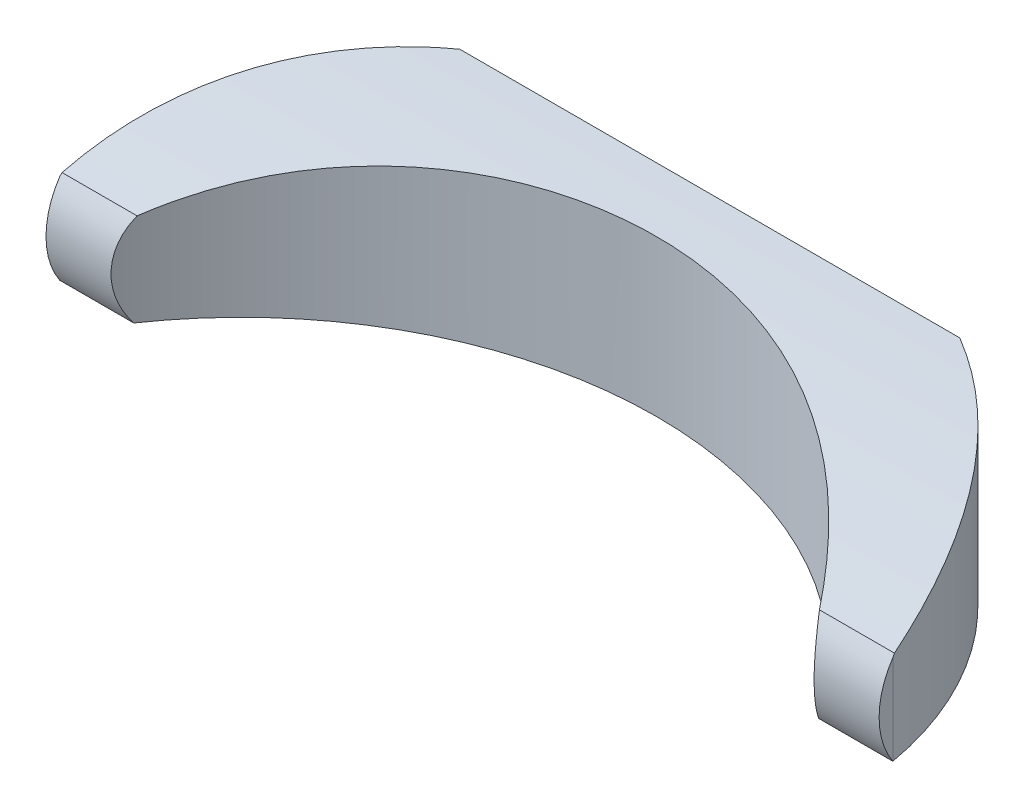
from build123d import *

# Parameters (mm, degrees)
SKETCH2_W           = 500
SKETCH2_H           = 150
BOSS_EXTRUDE1_DEPTH = 100
CUT_EXTRUDE1_DEPTH  = 540
SKETCH5_R           = 249.318658331
CUT_EXTRUDE2_DEPTH  = 560
CUT_EXTRUDE3_DEPTH  = 560


with BuildPart() as part:
    # Sketch2 → Boss-Extrude1 (new body)
    with BuildSketch(Plane(origin=(0, 0, 0), x_dir=(1, 0, 0), z_dir=(0, 1, 0))):
        with Locations((96.358792185, 13.36589698)):
            Rectangle(SKETCH2_W, SKETCH2_H)
    extrude(amount=BOSS_EXTRUDE1_DEPTH)

    # Sketch4 → Cut-Extrude1 (cut)
    with BuildSketch(Plane.ZY.offset(153.641207815)):
        with BuildLine():
            Line((-88.36589698, 100), (61.63410302, 100))
            Line((61.63410302, 100), (61.63410302, 50))
            Line((61.63410302, 50), (61.63410302, 0))
            Line((61.63410302, 0), (51.789240426, 0))
            ThreePointArc((51.789240426, 0), (60.017726044, 27.945379527), (50.617731539, 55.518778225))
            ThreePointArc((50.617731539, 55.518778225), (-17.284897104, 82.724872852), (-88.36589698, 100))
        make_face()
    extrude(amount=-CUT_EXTRUDE1_DEPTH, mode=Mode.SUBTRACT)

    # Sketch5 → Cut-Extrude2 (cut)
    with BuildSketch(Plane(origin=(0, 100, 0), x_dir=(-1, 0, 0), z_dir=(0, -1, 0))):
        with Locations((-96.358792185, -192.841012905)):
            Circle(SKETCH5_R)
    extrude(amount=CUT_EXTRUDE2_DEPTH, mode=Mode.SUBTRACT)

    # Sketch6 → Cut-Extrude3 (cut)
    with BuildSketch(Plane(origin=(0, 100, 0), x_dir=(-1, 0, 0), z_dir=(0, -1, 0))):
        with BuildLine():
            Line((-246.358792185, 88.36589698), (-346.358792185, 88.36589698))
            Line((-346.358792185, 88.36589698), (-346.358792185, -51.789240426))
            ThreePointArc((-346.358792185, -51.789240426), (-312.212496259, 29.599868023), (-246.358792185, 88.36589698))
        make_face()
        with BuildLine():
            Line((53.641207815, 88.36589698), (153.641207815, 88.36589698))
            Line((153.641207815, 88.36589698), (153.641207815, -51.789240426))
            ThreePointArc((153.641207815, -51.789240426), (119.49491189, 29.599868023), (53.641207815, 88.36589698))
        make_face()
    extrude(amount=CUT_EXTRUDE3_DEPTH, mode=Mode.SUBTRACT)


solid = part.part
